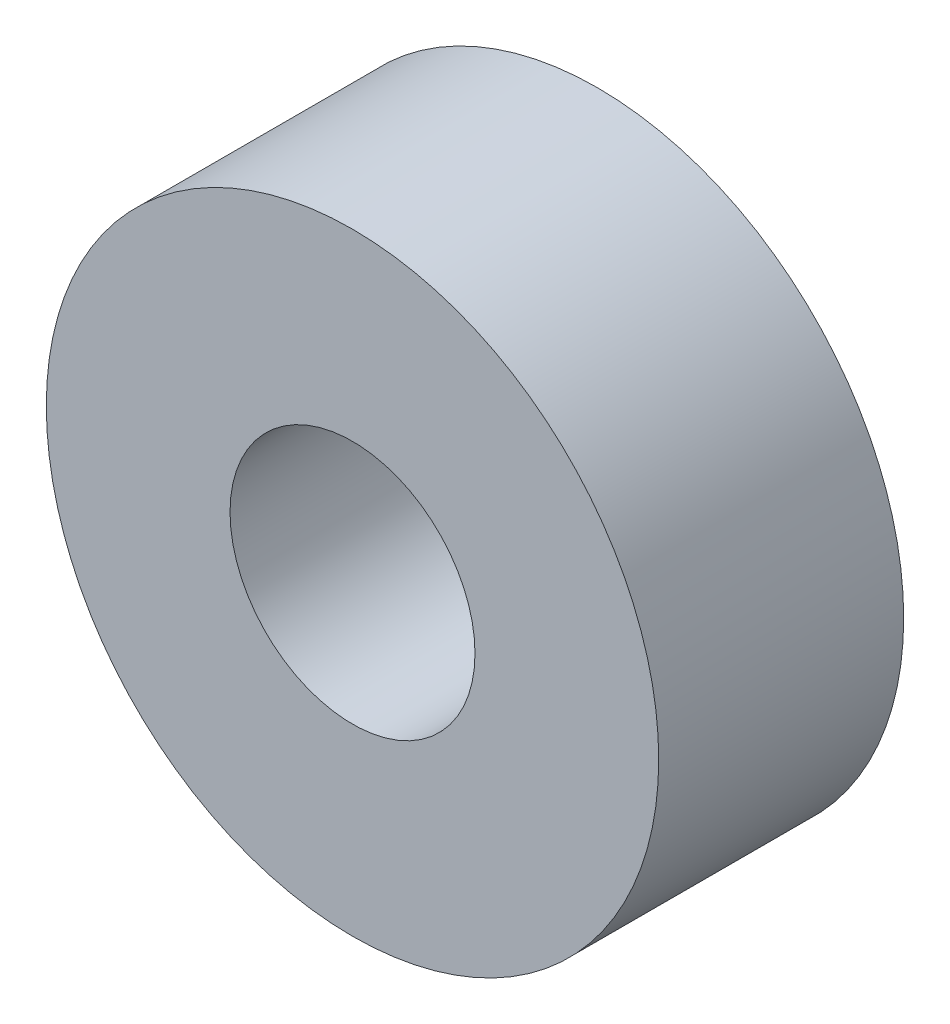
from build123d import *

# Parameters (mm, degrees)
BEARINGSKE_R   = 2.5
BEARINGSKE_R_2 = 1
BEARING_DEPTH  = 2


with BuildPart() as part:
    # BearingSke → Bearing (new body)
    with BuildSketch(Plane.XY):
        Circle(BEARINGSKE_R)
        Circle(BEARINGSKE_R_2, mode=Mode.SUBTRACT)
    extrude(amount=BEARING_DEPTH)


solid = part.part
